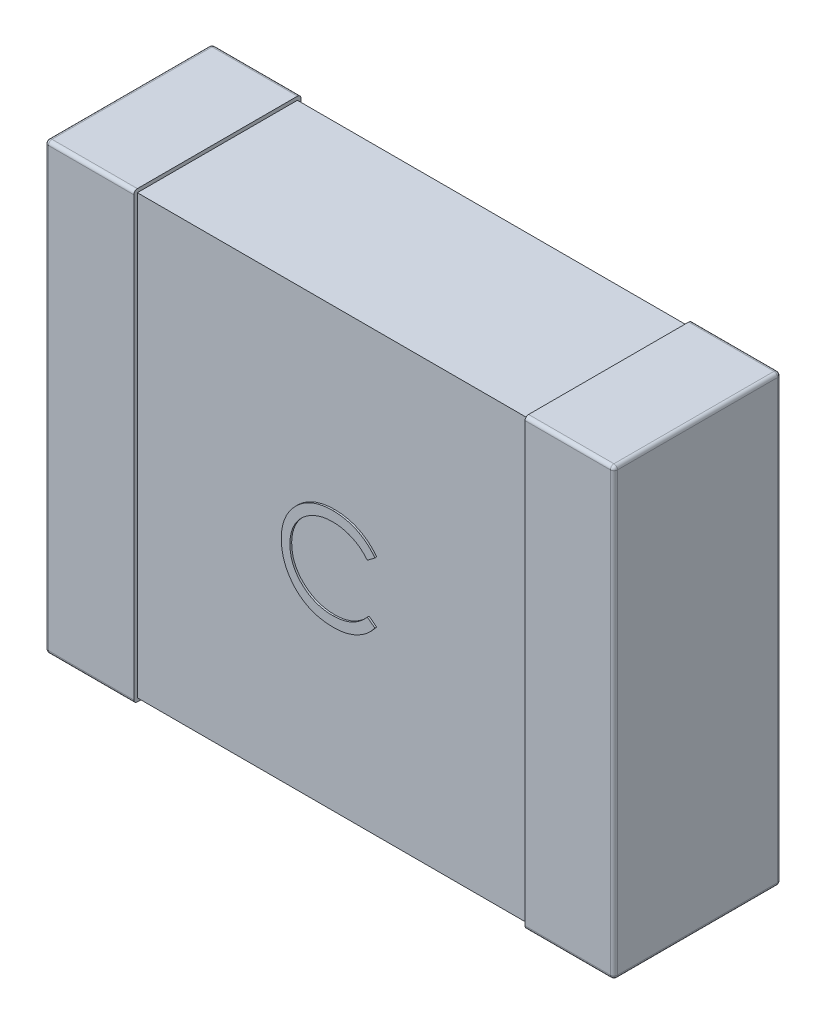
from build123d import *

# Parameters (mm, degrees)
EXTRUDE_1_DEPTH        = 0.92
EXTRUDE_1_DEPTH_BACK   = 0.02
SKETCH_3_W             = 0.5
SKETCH_3_H             = 2.5
EXTRUDE_1_2_DEPTH      = 0.92
EXTRUDE_1_2_DEPTH_BACK = 0.02
SKETCH_5_W             = 0.9
SKETCH_5_H             = 2.46
EXTRUDE_3_DEPTH        = 1.11
FILLET_3_R             = 0.02
EXTRUDE_4_DEPTH        = 0.01


with BuildPart() as part:
    # 草图3 → 凸台-拉伸1 (new, two sides: drawn at the far end of the back side and taken through both)
    with BuildSketch(Plane.XY.offset(-EXTRUDE_1_DEPTH_BACK)):
        with Locations((-1.35, 0)):
            Rectangle(SKETCH_3_W, SKETCH_3_H)
    extrude(amount=EXTRUDE_1_DEPTH + EXTRUDE_1_DEPTH_BACK)



with BuildPart() as body_2:
    # 草图3 → Extrude 1 2 (new, two sides: drawn at the far end of the back side and taken through both)
    with BuildSketch(Plane.XY.offset(-EXTRUDE_1_2_DEPTH_BACK)):
        with Locations((1.35, 0)):
            Rectangle(SKETCH_3_W, SKETCH_3_H)
    extrude(amount=EXTRUDE_1_2_DEPTH + EXTRUDE_1_2_DEPTH_BACK)


with BuildPart() as part_1:
    add(part.part)

    add(body_2.part)  # 凸台-拉伸3 merges body 2
    # 草图5 → 凸台-拉伸3 (add, symmetric)
    with BuildSketch(Plane(origin=(0, 0, 0), x_dir=(0, 0, -1), z_dir=(1, 0, 0))):
        with Locations((-0.45, 0)):
            Rectangle(SKETCH_5_W, SKETCH_5_H)
    extrude(amount=EXTRUDE_3_DEPTH, both=True)

    # 圆角3
    fillet_3_edges = [part_1.edges().sort_by_distance(p)[0] for p in [
        (-1.6, 0, -0.02),
        (-1.35, 1.25, 0.92),
        (-1.35, -1.25, -0.02),
        (-1.6, 0, 0.92),
        (-1.35, -1.25, 0.92),
        (1.6, 1.25, 0.45),
        (1.6, 0, -0.02),
        (1.6, -1.25, 0.45),
        (1.35, -1.25, -0.02),
        (1.35, 1.25, -0.02),
        (1.6, 0, 0.92),
        (1.35, 1.25, 0.92),
        (1.35, -1.25, 0.92),
        (-1.35, 1.25, -0.02),
        (-1.6, -1.25, 0.45),
        (-1.6, 1.25, 0.45),
    ]]
    fillet(fillet_3_edges, radius=FILLET_3_R)

    # 草图6 → 凸台-拉伸4 (add)
    with BuildSketch(Plane.XY.offset(0.9)):
        with BuildLine():
            Line((0.245585191, 0.128901731), (0.203181345, 0.096449807))
            add(Edge.make_bspline(
                [(0.203181345, 0.096449807), (0.200156436, 0.100054843), (0.194147402, 0.10721631), (0.184479982, 0.117272582), (0.174404871, 0.12669408), (0.163925921, 0.135525684), (0.152854514, 0.143458557), (0.141458848, 0.150906098), (0.129548292, 0.157581692), (0.113078025, 0.165675981), (0.091532357, 0.174122531), (0.064409724, 0.181204744), (0.036096583, 0.185713154), (0.016780382, 0.186201444), (0.006955383, 0.186449807)],
                knots=[0, 0, 0, 0, 0.757959112, 1.505699292, 2.245454638, 2.979532153, 3.711538275, 4.438200793, 5.171680507, 5.909471876, 7.393775596, 8.890124382, 10.418191784, 12, 12, 12, 12], degree=3))
            add(Edge.make_bspline(
                [(0.006955383, 0.186449807), (0.001542531, 0.186387482), (-0.009232936, 0.186263409), (-0.025224415, 0.184626573), (-0.040917286, 0.182325986), (-0.05630134, 0.178912365), (-0.071356997, 0.174596589), (-0.086182682, 0.169439525), (-0.100563746, 0.163059064), (-0.114699131, 0.156006933), (-0.128242209, 0.148041555), (-0.141056417, 0.13935321), (-0.153095018, 0.130039121), (-0.164367535, 0.120064378), (-0.174885493, 0.109473905), (-0.184572678, 0.098154835), (-0.19339557, 0.086143356), (-0.201529053, 0.073597859), (-0.208813304, 0.060554886), (-0.214912199, 0.046966161), (-0.22031299, 0.033064385), (-0.224586587, 0.018692491), (-0.227969227, 0.003951607), (-0.230303209, -0.011197828), (-0.23192143, -0.026724168), (-0.232044886, -0.03724789), (-0.232107117, -0.042552596)],
                knots=[0, 0, 0, 0, 1.054917814, 2.100044995, 3.131103042, 4.146048494, 5.169673617, 6.183595914, 7.203665975, 8.234915748, 9.262203917, 10.264457458, 11.251630812, 12.227803204, 13.197192746, 14.159520551, 15.12972552, 16.100847026, 17.073214652, 18.039054194, 19.002613845, 19.979014051, 20.95965708, 21.949030935, 22.966165397, 24, 24, 24, 24], degree=3))
            add(Edge.make_bspline(
                [(-0.232107117, -0.042552596), (-0.231912436, -0.050534), (-0.231530207, -0.066204427), (-0.228128464, -0.089157607), (-0.222959107, -0.111146511), (-0.215211561, -0.132033687), (-0.205658336, -0.152076691), (-0.193586927, -0.1709364), (-0.17960609, -0.188897812), (-0.163518036, -0.205536439), (-0.145866853, -0.220735699), (-0.126928604, -0.234120074), (-0.106750457, -0.245277228), (-0.085555205, -0.254561517), (-0.063179748, -0.261698269), (-0.039664321, -0.266722448), (-0.01506007, -0.269999813), (0.001752351, -0.270313582), (0.010308749, -0.270473269)],
                knots=[0, 0, 0, 0, 1.029171465, 2.020641659, 2.987623507, 3.938342917, 4.889210282, 5.84687017, 6.821220943, 7.821438502, 8.827599549, 9.822697543, 10.807740252, 11.797342354, 12.80366471, 13.83203677, 14.896651826, 16, 16, 16, 16], degree=3))
            add(Edge.make_bspline(
                [(0.010308749, -0.270473269), (0.019736021, -0.270212715), (0.038291147, -0.269699881), (0.065502214, -0.265355311), (0.091551161, -0.258310947), (0.116439388, -0.24845241), (0.140096734, -0.235636623), (0.162560218, -0.220100379), (0.183848804, -0.201695893), (0.196650087, -0.187643068), (0.203181345, -0.180473269)],
                knots=[0, 0, 0, 0, 1.028121516, 2.023589091, 2.998037872, 3.967518031, 4.937445131, 5.927275754, 6.942489185, 8, 8, 8, 8], degree=3))
            Line((0.203181345, -0.180473269), (0.245585191, -0.212600673))
            add(Edge.make_bspline(
                [(0.245585191, -0.212600673), (0.242172682, -0.217003749), (0.235364011, -0.225788809), (0.22433906, -0.238173587), (0.212724849, -0.249822781), (0.20043511, -0.260642471), (0.187611223, -0.27084916), (0.174022923, -0.280152871), (0.159848844, -0.288683465), (0.14513701, -0.296494476), (0.129903052, -0.303424566), (0.114165225, -0.309357433), (0.097991365, -0.31446813), (0.081380732, -0.318672715), (0.064298873, -0.321954539), (0.046807428, -0.324148432), (0.028868647, -0.32565147), (0.016766257, -0.325788463), (0.010633268, -0.325857885)],
                knots=[0, 0, 0, 0, 0.986787822, 1.968848986, 2.935600012, 3.899624008, 4.868462664, 5.837806735, 6.815139263, 7.798259679, 8.787526145, 9.778297419, 10.776456485, 11.791383307, 12.812564526, 13.85620153, 14.913611965, 16, 16, 16, 16], degree=3))
            add(Edge.make_bspline(
                [(0.010633268, -0.325857885), (0.004825388, -0.325817463), (-0.006658976, -0.325737534), (-0.023614783, -0.324442743), (-0.040121747, -0.322676212), (-0.056132689, -0.320016306), (-0.071734983, -0.316877465), (-0.086787187, -0.3126699), (-0.10143742, -0.3079566), (-0.115626821, -0.302416973), (-0.12936746, -0.296165905), (-0.14261502, -0.289100921), (-0.155363406, -0.281281434), (-0.167737957, -0.272879804), (-0.17955587, -0.263626163), (-0.190919557, -0.253649025), (-0.201892739, -0.242982017), (-0.208681724, -0.235290126), (-0.212095098, -0.231422789)],
                knots=[0, 0, 0, 0, 1.114604814, 2.203992996, 3.262667896, 4.300477797, 5.318619304, 6.316056647, 7.298880507, 8.271930387, 9.238335007, 10.195173496, 11.151986948, 12.108099108, 13.064862484, 14.031167946, 15.010108607, 16, 16, 16, 16], degree=3))
            add(Edge.make_bspline(
                [(-0.212095098, -0.231422789), (-0.217562311, -0.224705005), (-0.228430733, -0.211350541), (-0.242335839, -0.189706419), (-0.254238604, -0.167108466), (-0.263862318, -0.143437963), (-0.271385711, -0.118748023), (-0.276597667, -0.093026201), (-0.279984486, -0.066296519), (-0.280371788, -0.048115985), (-0.280568655, -0.038874712)],
                knots=[0, 0, 0, 0, 0.994628077, 1.977248131, 2.950237994, 3.925870899, 4.908910175, 5.911660606, 6.938484602, 8, 8, 8, 8], degree=3))
            add(Edge.make_bspline(
                [(-0.280568655, -0.038874712), (-0.280328711, -0.029161585), (-0.279856636, -0.010051613), (-0.275845856, 0.017993511), (-0.269393813, 0.044862584), (-0.260229722, 0.070505447), (-0.248611182, 0.095056976), (-0.234258504, 0.118329619), (-0.217338431, 0.140472211), (-0.197983664, 0.161148773), (-0.176758989, 0.180054844), (-0.1540298, 0.196687801), (-0.129840586, 0.210529933), (-0.104457832, 0.222100769), (-0.077691469, 0.230994486), (-0.049598607, 0.237220406), (-0.020232031, 0.241095619), (-0.000196114, 0.241585508), (0.009984229, 0.241834423)],
                knots=[0, 0, 0, 0, 1.032925535, 2.032216505, 3.007276963, 3.968222605, 4.92396291, 5.891752235, 6.871517503, 7.883894988, 8.900124299, 9.891468569, 10.874487609, 11.85992873, 12.854644235, 13.869047385, 14.917252991, 16, 16, 16, 16], degree=3))
            add(Edge.make_bspline(
                [(0.009984229, 0.241834423), (0.016188748, 0.241760036), (0.028469967, 0.241612794), (0.046637519, 0.240176989), (0.064325193, 0.237783462), (0.081545173, 0.234525554), (0.098381234, 0.230482138), (0.114704699, 0.225214778), (0.130611354, 0.219191999), (0.146000877, 0.21225555), (0.16079943, 0.204469253), (0.175002405, 0.195919414), (0.188496983, 0.186616632), (0.20137812, 0.176640028), (0.213430335, 0.165778536), (0.224995821, 0.154330907), (0.235681816, 0.141967403), (0.242278023, 0.133264927), (0.245585191, 0.128901731)],
                knots=[0, 0, 0, 0, 1.096760587, 2.17092713, 3.219439832, 4.250915756, 5.268269357, 6.278326846, 7.281116186, 8.274029601, 9.260640565, 10.235837813, 11.203064059, 12.156899882, 13.114053108, 14.069676657, 15.032185724, 16, 16, 16, 16], degree=3))
        make_face()
    extrude(amount=EXTRUDE_4_DEPTH)


solid = part_1.part
